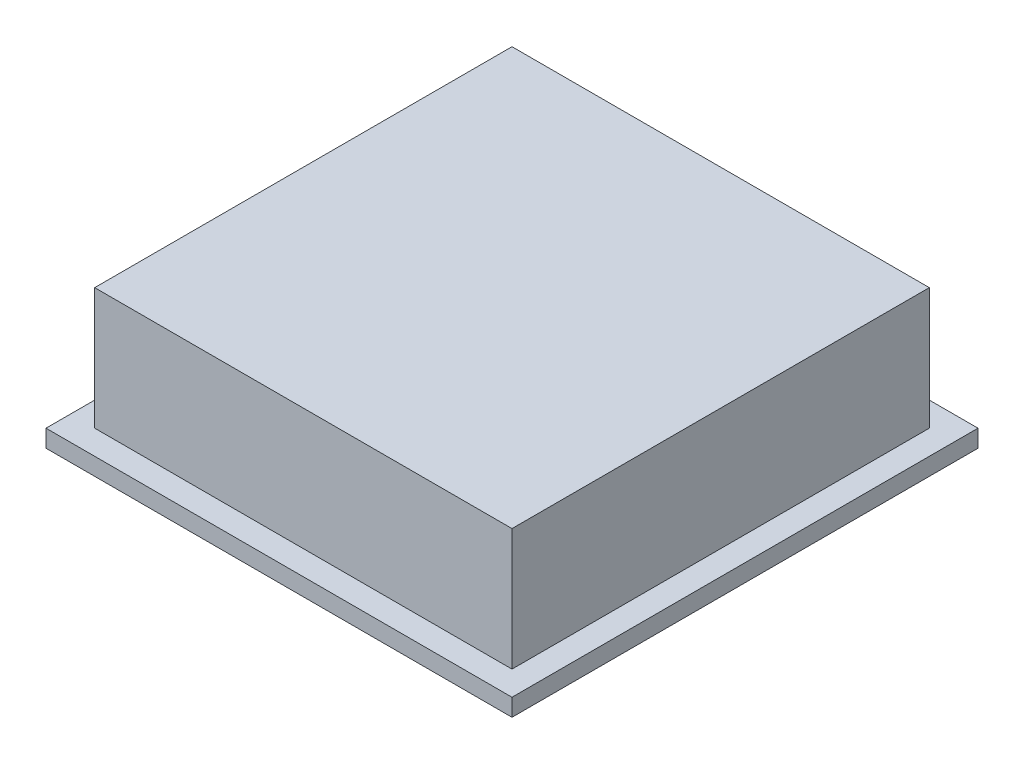
from build123d import *

# Parameters (mm, degrees)
SKETCH3_W           = 13.4
SKETCH3_H           = 13.4
BOSS_EXTRUDE2_DEPTH = 0.5
SKETCH4_W           = 12
SKETCH4_H           = 12
BOSS_EXTRUDE3_DEPTH = 4


with BuildPart() as part:
    # Sketch3 → Boss-Extrude2 (new body)
    with BuildSketch(Plane(origin=(0, 0, 0), x_dir=(1, 0, 0), z_dir=(0, 1, 0))):
        Rectangle(SKETCH3_W, SKETCH3_H)
    extrude(amount=BOSS_EXTRUDE2_DEPTH)

    # Sketch4 → Boss-Extrude3 (add)
    with BuildSketch(Plane(origin=(0, 0, 0), x_dir=(1, 0, 0), z_dir=(0, 1, 0))):
        Rectangle(SKETCH4_W, SKETCH4_H)
    extrude(amount=BOSS_EXTRUDE3_DEPTH)


solid = part.part
